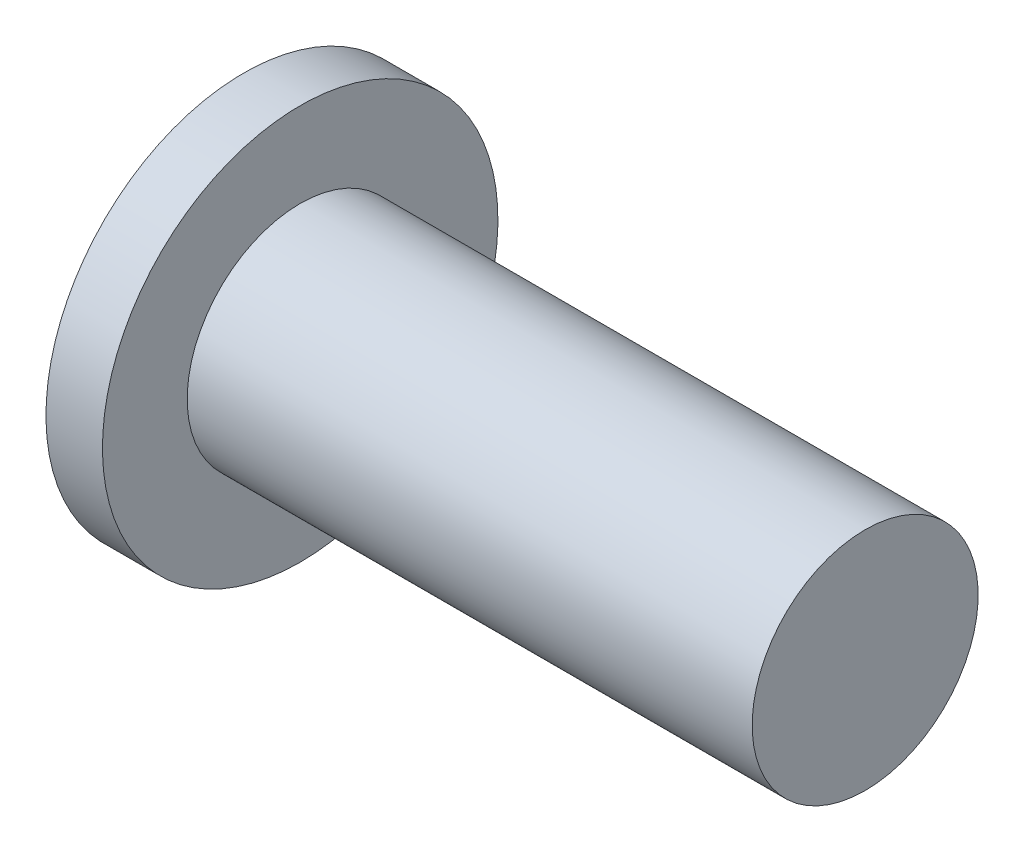
from build123d import *


with BuildPart() as part:
    # 草图1 → 旋转1 (revolve)
    with BuildSketch(Plane.XY, mode=Mode.PRIVATE) as revolve_1_sk:
        Polygon((0, 0), (10, 0), (10, -2), (-1, -2), (-1, 1.5), (0, 1.5), align=None)
    revolve(revolve_1_sk.sketch.rotate(Axis((-1, -2, 0), (1, 0, 0)), 180), axis=Axis((-1, -2, 0), (1, 0, 0)))


solid = part.part
